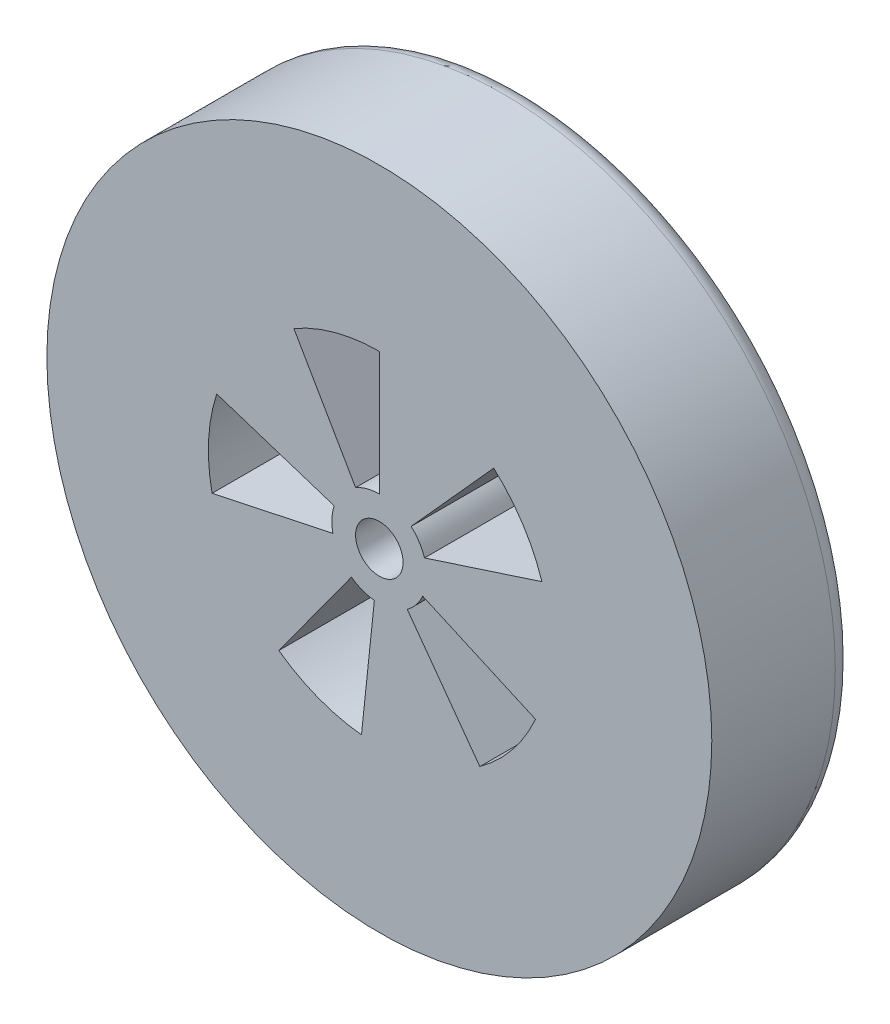
from build123d import *

# Parameters (mm, degrees)
SKETCH1_R           = 35
BOSS_EXTRUDE1_DEPTH = 15
SKETCH2_R           = 20
CUT_EXTRUDE1_DEPTH  = 3
FILLET1_R           = 2
FILLET2_R           = 2
SKETCH4_R           = 2.5
CUT_EXTRUDE2_DEPTH  = 51.931326382
CUT_EXTRUDE3_DEPTH  = 51.931326382


with BuildPart() as part:
    # Sketch1 → Boss-Extrude1 (new body)
    with BuildSketch(Plane.XY):
        Circle(SKETCH1_R)
    extrude(amount=BOSS_EXTRUDE1_DEPTH)

    # Sketch2 → Cut-Extrude1 (cut)
    with BuildSketch(Plane(origin=(0, 0, 0), x_dir=(-1, 0, 0), z_dir=(0, 0, -1))):
        Circle(SKETCH2_R)
    extrude(amount=-CUT_EXTRUDE1_DEPTH, mode=Mode.SUBTRACT)

    # Fillet1
    fillet1_edges = [part.edges().sort_by_distance(p)[0] for p in [
        (-35, 0, 0),
    ]]
    fillet(fillet1_edges, radius=FILLET1_R)

    # Fillet2
    fillet2_edges = [part.edges().sort_by_distance(p)[0] for p in [
        (20, 0, 3),
    ]]
    fillet(fillet2_edges, radius=FILLET2_R)

    # Sketch4 → Cut-Extrude2 (cut, through all)
    with BuildSketch(Plane(origin=(0, 0, 3), x_dir=(-1, 0, 0), z_dir=(0, 0, -1))):
        Circle(SKETCH4_R)
    extrude(amount=-CUT_EXTRUDE2_DEPTH, mode=Mode.SUBTRACT)

    # Sketch5 → Cut-Extrude3 (cut, through all)
    with BuildSketch(Plane(origin=(0, 0, 3), x_dir=(-1, 0, 0), z_dir=(0, 0, -1))):
        with BuildLine():
            Line((0, 5), (0, 18))
            ThreePointArc((0, 18), (4.658742812, 17.386664873), (9, 15.588457268))
            Line((9, 15.588457268), (2.5, 4.330127019))
            ThreePointArc((2.5, 4.330127019), (1.294095226, 4.829629131), (0, 5))
        make_face()
        with BuildLine():
            Line((4.890738004, -1.039558454), (17.606656813, -3.742410435))
            ThreePointArc((17.606656813, -3.742410435), (17.975331626, 0.942047212), (17.119017293, 5.562305899))
            Line((17.119017293, 5.562305899), (4.755282581, 1.545084972))
            ThreePointArc((4.755282581, 1.545084972), (4.993147674, 0.261679781), (4.890738004, -1.039558454))
        make_face()
        with BuildLine():
            Line((0.522642316, -4.972609477), (1.881512339, -17.901394117))
            ThreePointArc((1.881512339, -17.901394117), (6.450623092, -16.804447677), (10.580134541, -14.562305899))
            Line((10.580134541, -14.562305899), (2.938926261, -4.045084972))
            ThreePointArc((2.938926261, -4.045084972), (1.791839748, -4.667902132), (0.522642316, -4.972609477))
        make_face()
        with BuildLine():
            Line((-4.567727288, -2.033683215), (-16.443818238, -7.321259575))
            ThreePointArc((-16.443818238, -7.321259575), (-13.988627306, -11.327767039), (-10.580134541, -14.562305899))
            Line((-10.580134541, -14.562305899), (-2.938926261, -4.045084972))
            ThreePointArc((-2.938926261, -4.045084972), (-3.885729807, -3.146601955), (-4.567727288, -2.033683215))
        make_face()
        with BuildLine():
            Line((-3.345653032, 3.715724127), (-12.044350914, 13.376606859))
            ThreePointArc((-12.044350914, 13.376606859), (-15.096070223, 9.80350263), (-17.119017293, 5.562305899))
            Line((-17.119017293, 5.562305899), (-4.755282581, 1.545084972))
            ThreePointArc((-4.755282581, 1.545084972), (-4.19335284, 2.723195175), (-3.345653032, 3.715724127))
        make_face()
    extrude(amount=-CUT_EXTRUDE3_DEPTH, mode=Mode.SUBTRACT)


solid = part.part
